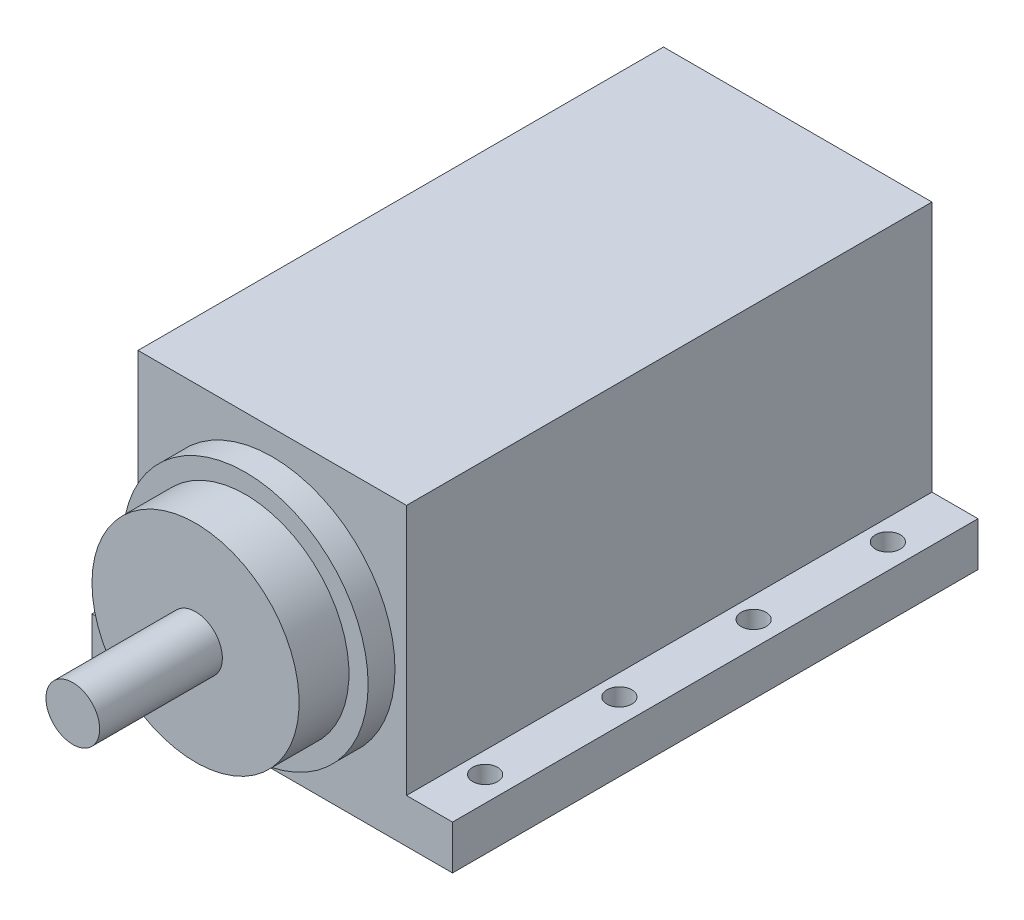
from build123d import *

# Parameters (mm, degrees)
BOSS_EXTRU_1_DEPTH           = 137
ESQUISSE2_R                  = 32
BOSS_EXTRU_2_DEPTH           = 7
ESQUISSE3_R                  = 27
BOSS_EXTRU_3_DEPTH           = 13
ESQUISSE4_R                  = 7
BOSS_EXTRU_4_DEPTH           = 32
ENL_V_MAT_EXTRU_1_DEPTH      = 206.475667659
ENL_V_MAT_EXTRU_1_DEPTH_BACK = 206.475667659
ESQUISSE5_R                  = 3.25


with BuildPart() as part:
    # Esquisse1 → Boss.-Extru.1 (new body)
    with BuildSketch(Plane.XY):
        Polygon((-47, 0), (47, 0), (47, 11.5), (35, 11.5), (35, 77), (-35, 77), (-35, 11.5), (-47, 11.5), align=None)
    extrude(amount=BOSS_EXTRU_1_DEPTH)

    # Esquisse2 → Boss.-Extru.2 (add)
    with BuildSketch(Plane.XY.offset(137)):
        with Locations((0, 38.5)):
            Circle(ESQUISSE2_R)
    extrude(amount=BOSS_EXTRU_2_DEPTH)

    # Esquisse3 → Boss.-Extru.3 (add)
    with BuildSketch(Plane.XY.offset(144)):
        with Locations(Location((0, 38.5, 0), (0, 0, 180))):
            Circle(ESQUISSE3_R)
    extrude(amount=BOSS_EXTRU_3_DEPTH)

    # Esquisse4 → Boss.-Extru.4 (add)
    with BuildSketch(Plane.XY.offset(157)):
        with Locations((0, 38.5)):
            Circle(ESQUISSE4_R)
    extrude(amount=BOSS_EXTRU_4_DEPTH)

    # Esquisse5 → Enlèv. mat.-Extru.1 (cut, two sides: drawn at the far end of the back side and taken through both)
    with BuildSketch(Plane(origin=(0, 11.5, 0), x_dir=(1, 0, 0), z_dir=(0, 1, 0)).offset(-ENL_V_MAT_EXTRU_1_DEPTH_BACK)):
        with Locations(Location((40.5, -122, 0), (0, 0, 270))):
            Circle(ESQUISSE5_R)
        with Locations(Location((40.5, -87, 0), (0, 0, 270))):
            Circle(ESQUISSE5_R)
        with Locations(Location((40.5, -52, 0), (0, 0, 270))):
            Circle(ESQUISSE5_R)
        with Locations(Location((40.5, -17, 0), (0, 0, 270))):
            Circle(ESQUISSE5_R)
        with Locations(Location((-40.5, -17, 0), (0, 0, 90))):
            Circle(ESQUISSE5_R)
        with Locations(Location((-40.5, -52, 0), (0, 0, 90))):
            Circle(ESQUISSE5_R)
        with Locations(Location((-40.5, -87, 0), (0, 0, 90))):
            Circle(ESQUISSE5_R)
        with Locations(Location((-40.5, -122, 0), (0, 0, 90))):
            Circle(ESQUISSE5_R)
    extrude(amount=ENL_V_MAT_EXTRU_1_DEPTH + ENL_V_MAT_EXTRU_1_DEPTH_BACK, mode=Mode.SUBTRACT)


solid = part.part
